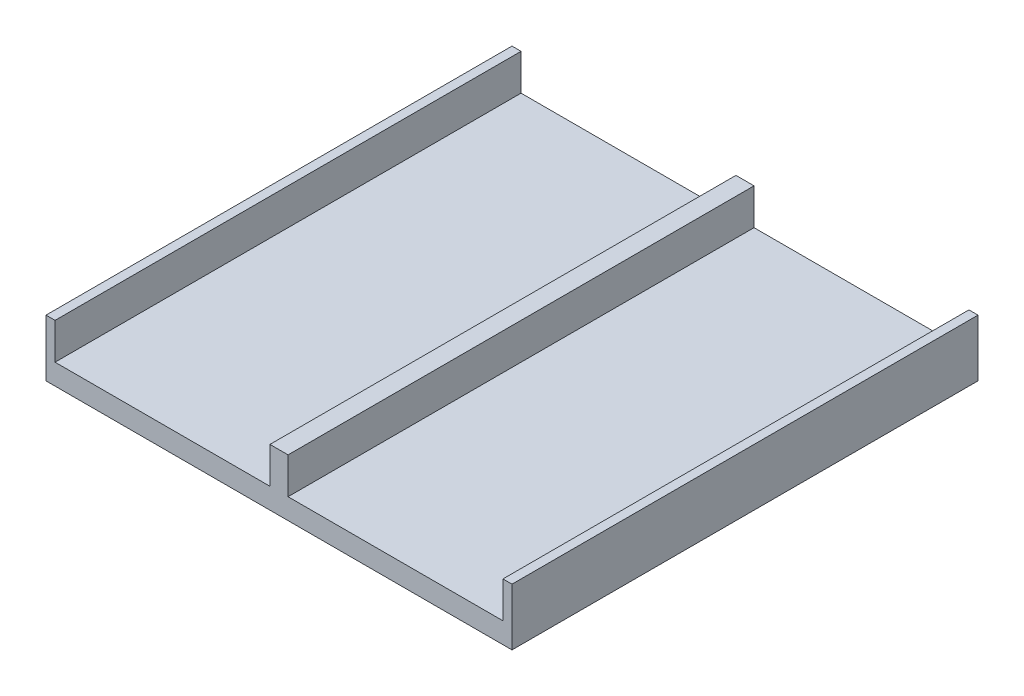
from build123d import *

# Parameters (mm, degrees)
SKETCH1_W           = 90
SKETCH1_H           = 90
BOSS_EXTRUDE1_DEPTH = 11
SKETCH2_W           = 41.5
SKETCH2_H           = 90
CUT_EXTRUDE2_DEPTH  = 7


with BuildPart() as part:
    # Sketch1 → Boss-Extrude1 (new body)
    with BuildSketch(Plane(origin=(0, 0, 0), x_dir=(1, 0, 0), z_dir=(0, 1, 0))):
        Rectangle(SKETCH1_W, SKETCH1_H)
    extrude(amount=BOSS_EXTRUDE1_DEPTH)

    # Sketch2 → Cut-Extrude2 (cut)
    with BuildSketch(Plane(origin=(0, 11, 0), x_dir=(1, 0, 0), z_dir=(0, 1, 0))):
        with Locations((-22.5, 0)):
            Rectangle(SKETCH2_W, SKETCH2_H)
        with Locations((22.5, 0)):
            Rectangle(SKETCH2_W, SKETCH2_H)
    extrude(amount=-CUT_EXTRUDE2_DEPTH, mode=Mode.SUBTRACT)


solid = part.part
